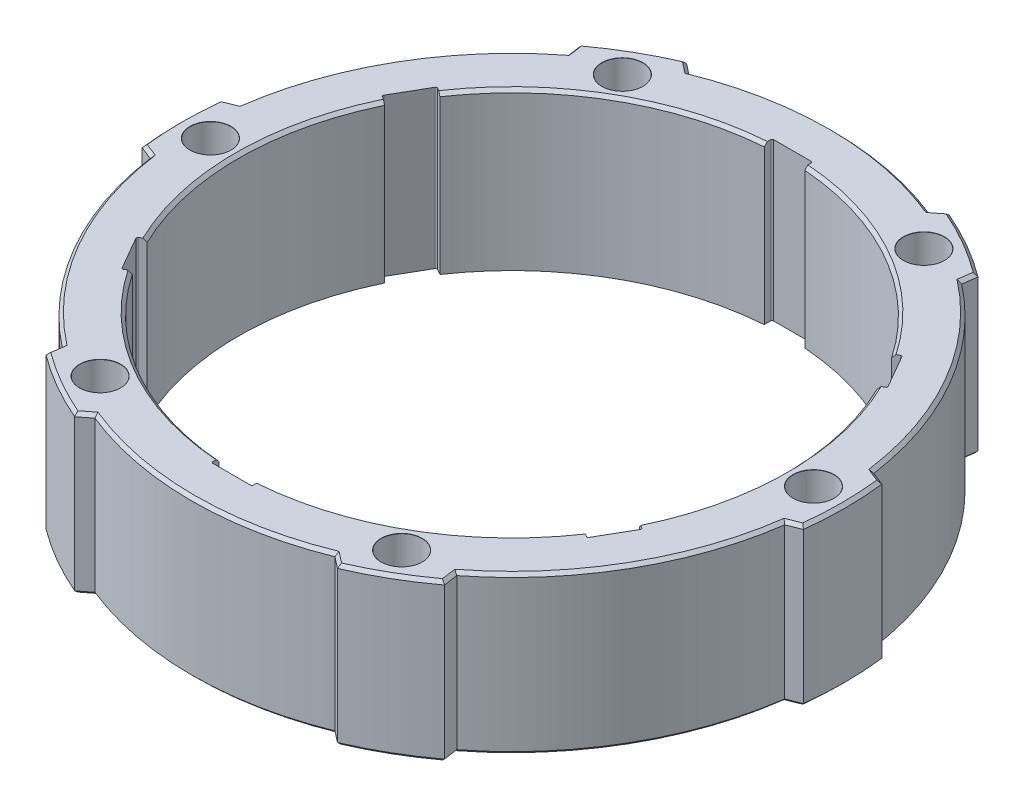
from build123d import *

# Parameters (mm, degrees)
BODY_SKETCH_R                           = 53
BODY_SKETCH_R_2                         = 43.5
BODY_DEPTH                              = 25
SIDE_CUTOUTS_DEPTH                      = 80.012657213892
DRIVING_CUTOUT_DEPTH                    = 80.012657213892
DRIVING_CUTOUT_FILLET_R                 = 0.25
MAIN_PATTERN_COUNT                      = 6
DRIVING_CUTOUT_FILLET_OF_MAIN_PATTERN_R = 0.25
OVERALL_CHAMFER_SIZE                    = 0.5


with BuildPart() as part:
    # body_sketch → body (new body)
    with BuildSketch(Plane(origin=(0, 0, 0), x_dir=(1, 0, 0), z_dir=(0, 1, 0))):
        with Locations(Location((0, 0, 0), (0, 0, 270))):
            Circle(BODY_SKETCH_R)
        with Locations(Location((0, 0, 0), (0, 0, 270))):
            Circle(BODY_SKETCH_R_2, mode=Mode.SUBTRACT)
    extrude(amount=BODY_DEPTH)

    # Sketch4 → spring_screw_hole (revolve, cut)
    with BuildSketch(Plane(origin=(48, 25, 0), x_dir=(0, 0, 1), z_dir=(1, 0, 0))):
        Polygon((0, 0), (-6.12e-15, 25), (1.6999999999999937, 25), (1.6999999999999953, 20), (3.249999999999998, 20), (3.2499999999999996, 0.02500000000000014), (3.2750000000000004, -3.47e-15), align=None)
    spring_screw_hole = revolve(axis=Axis((48, 31.34999999999999, 0), (0, -1, 0)), mode=Mode.SUBTRACT)

    # Sketch5 → side_cutouts (cut, through all)
    with BuildSketch(Plane(origin=(0, 25, 0), x_dir=(1, 0, 0), z_dir=(0, 1, 0))):
        with BuildLine():
            Line((50.50367150582007, 7.0978281489633614), (52.63160922139086, 6.238085504929012))
            ThreePointArc((52.63160922139086, 6.238085504929012), (45.89934640057521, 26.50000000000007), (31.718145128943295, 42.461267875315386))
            Line((31.718145128943295, 42.461267875315386), (31.398735241608467, 40.188548433942906))
            ThreePointArc((31.398735241608467, 40.188548433942906), (44.16729559300632, 25.50000000000007), (50.50367150582007, 7.0978281489633614))
        make_face()
    side_cutouts = extrude(amount=-SIDE_CUTOUTS_DEPTH, mode=Mode.SUBTRACT)

    # Sketch6 → driving_cutout (cut, through all)
    with BuildSketch(Plane(origin=(0, 25, 0), x_dir=(1, 0, 0), z_dir=(0, 1, 0))):
        Polygon((39.180373410532546, 18.898368697092206), (35.95665408703264, 24.48201435473557), (37.03918584176319, 25.107014354735572), (40.26290516526309, 19.52336869709221), align=None)
    driving_cutout = extrude(amount=-DRIVING_CUTOUT_DEPTH, mode=Mode.SUBTRACT)

    # driving_cutout_fillet
    driving_cutout_fillet_edges = [part.edges().sort_by_distance(p)[0] for p in [
        (40.26290516526309, 12.5, -19.52336869709221),
        (37.03918584176319, 12.5, -25.107014354735572),
    ]]
    fillet(driving_cutout_fillet_edges, radius=DRIVING_CUTOUT_FILLET_R)

    # main_pattern: spring_screw_hole, side_cutouts, driving_cutout ×6 about axis
    main_pattern_axis = Axis((-6.81e-15, 0, -3.023e-14), (0, 1, 0))
    add([spring_screw_hole.rotate(main_pattern_axis, i * 360 / MAIN_PATTERN_COUNT) for i in range(1, MAIN_PATTERN_COUNT)], mode=Mode.SUBTRACT)
    add([side_cutouts.rotate(main_pattern_axis, i * 360 / MAIN_PATTERN_COUNT) for i in range(1, MAIN_PATTERN_COUNT)], mode=Mode.SUBTRACT)
    add([driving_cutout.rotate(main_pattern_axis, i * 360 / MAIN_PATTERN_COUNT) for i in range(1, MAIN_PATTERN_COUNT)], mode=Mode.SUBTRACT)

    # driving_cutout_fillet of main_pattern
    driving_cutout_fillet_of_main_pattern_edges = [part.edges().sort_by_distance(p)[0] for p in [
        (3.223719323499823, 12.5, -44.63038305182766),
        (-3.223719323499948, 12.5, -44.63038305182764),
        (-37.03918584176327, 12.5, -25.10701435473548),
        (-40.26290516526315, 12.5, -19.523368697092106),
        (-40.262905165263106, 12.5, 19.523368697092145),
        (-37.03918584176321, 12.5, 25.107014354735508),
        (-3.2237193234998545, 12.5, 44.630383051827586),
        (3.223719323499913, 12.5, 44.63038305182758),
        (37.03918584176327, 12.5, 25.107014354735416),
        (40.26290516526314, 12.5, 19.523368697092028),
    ]]
    fillet(driving_cutout_fillet_of_main_pattern_edges, radius=DRIVING_CUTOUT_FILLET_OF_MAIN_PATTERN_R)

    # overall_chamfer
    overall_chamfer_edges = [part.edges().sort_by_distance(p)[0] for p in [
        (-26.50000000000005, 25, -45.89934640057521),
        (-53, 25, 4.441e-14),
        (-26.49999999999998, 25, 45.89934640057526),
        (26.50000000000005, 25, 45.89934640057522),
        (53, 25, -8.882e-14),
        (-26.500000000000234, 0, -45.89934640057511),
        (-53, 0, 3.4461e-13),
        (-26.499999999999897, 0, 45.899346400575304),
        (26.499999999999336, 0, 45.89934640057564),
        (53, 0, -7.6383e-13),
        (-4.866e-14, 0, -51),
        (-20.00920017832957, -3.55e-15, -47.992864981575195),
        (20.009200178329486, -3.55e-15, -47.99286498157525),
        (-4.828e-14, 25, -51.00000000000001),
        (20.009200178329486, 25, -47.992864981575245),
        (-20.00920017832958, 25, -47.992864981575195),
        (-44.16729559300637, 0, -25.499999999999982),
        (-51.56764036360546, 0, -6.6679568269460905),
        (-31.558440185275984, 0, -41.3249081546291),
        (-44.16729559300637, 25, -25.499999999999986),
        (-31.558440185275984, 25, -41.3249081546291),
        (-51.56764036360547, 25, -6.667956826946094),
        (-44.167295593006365, 0, 25.499999999999954),
        (-31.5584401852759, -3.55e-15, 41.32490815462907),
        (-51.56764036360548, 0, 6.667956826946121),
        (-44.16729559300633, 25, 25.49999999999999),
        (-51.56764036360548, 25, 6.66795682694612),
        (-31.5584401852759, 25, 41.32490815462907),
        (1.728e-14, 0, 50.99999999999995),
        (20.009200178329543, 0, 47.99286498157514),
        (-20.009200178329515, -3.55e-15, 47.99286498157518),
        (1.334e-14, 25, 50.99999999999994),
        (-20.009200178329515, 25, 47.99286498157518),
        (20.009200178329543, 25, 47.99286498157514),
        (44.167295593006365, 0, 25.499999999999908),
        (51.56764036360546, 0, 6.667956826946016),
        (31.55844018527599, 0, 41.324908154629036),
        (44.167295593006365, 25, 25.499999999999908),
        (31.558440185275984, 25, 41.324908154629036),
        (51.567640363605456, 25, 6.667956826946016),
        (-21.750000000000043, 25, -37.67210506462306),
        (-43.5, 25, 2.753e-14),
        (-21.74999999999997, 25, 37.672105064623096),
        (21.75000000000005, 25, 37.672105064623054),
        (43.5, 25, -7.994e-14),
        (26.499999999999932, 25, -45.89934640057529),
        (26.499999999999876, 0, -45.899346400575325),
        (44.167295593006315, 0, -25.500000000000057),
        (31.55844018527588, -3.55e-15, -41.32490815462914),
        (51.56764036360546, 0, -6.667956826946186),
        (44.167295593006315, 25, -25.500000000000057),
        (51.56764036360546, 25, -6.667956826946186),
        (31.55844018527588, 25, -41.32490815462914),
        (21.74999999999994, 25, -37.67210506462312),
    ]]
    chamfer(overall_chamfer_edges, length=OVERALL_CHAMFER_SIZE)


solid = part.part
